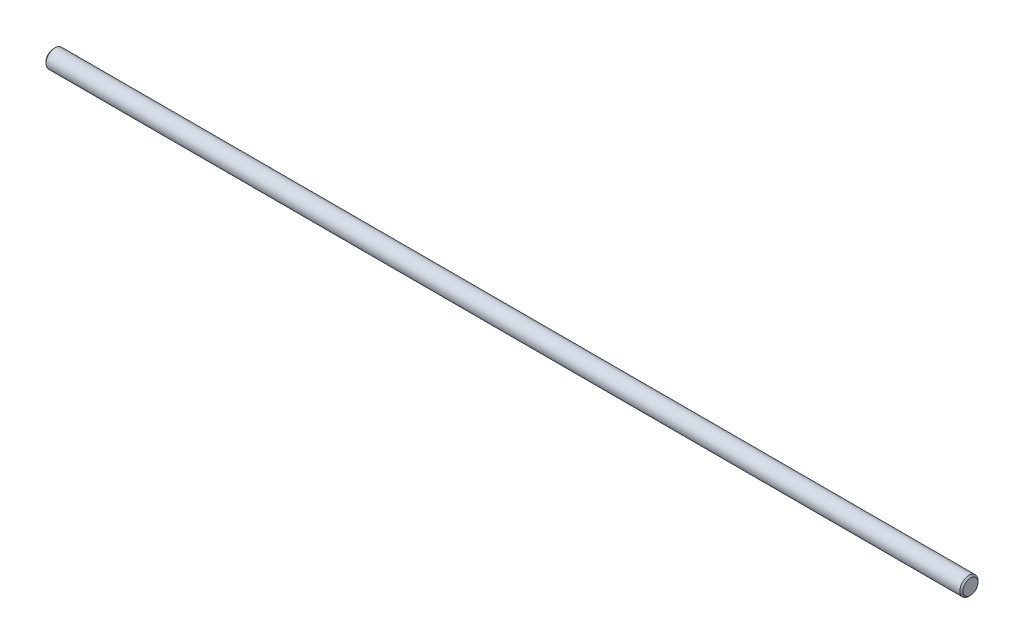
from build123d import *

# Parameters (mm, degrees)
CROQUIS1_R              = 3
SALIENTE_EXTRUIR1_DEPTH = 303.499999388
CHAFL_N1_SIZE           = 0.5


with BuildPart() as part:
    # Croquis1 → Saliente-Extruir1 (new body)
    with BuildSketch(Plane(origin=(419.915189324, 0, 0), x_dir=(0, 0, -1), z_dir=(1, 0, 0))):
        with Locations((158.838677326, -27.50000144)):
            Circle(CROQUIS1_R)
    extrude(amount=-SALIENTE_EXTRUIR1_DEPTH)

    # Chaflán1
    chafl_n1_edges = [part.edges().sort_by_distance(p)[0] for p in [
        (419.915189324, -27.50000144, -155.838677326),
        (116.415189936, -27.50000144, -155.838677326),
    ]]
    chamfer(chafl_n1_edges, length=CHAFL_N1_SIZE)


solid = part.part
